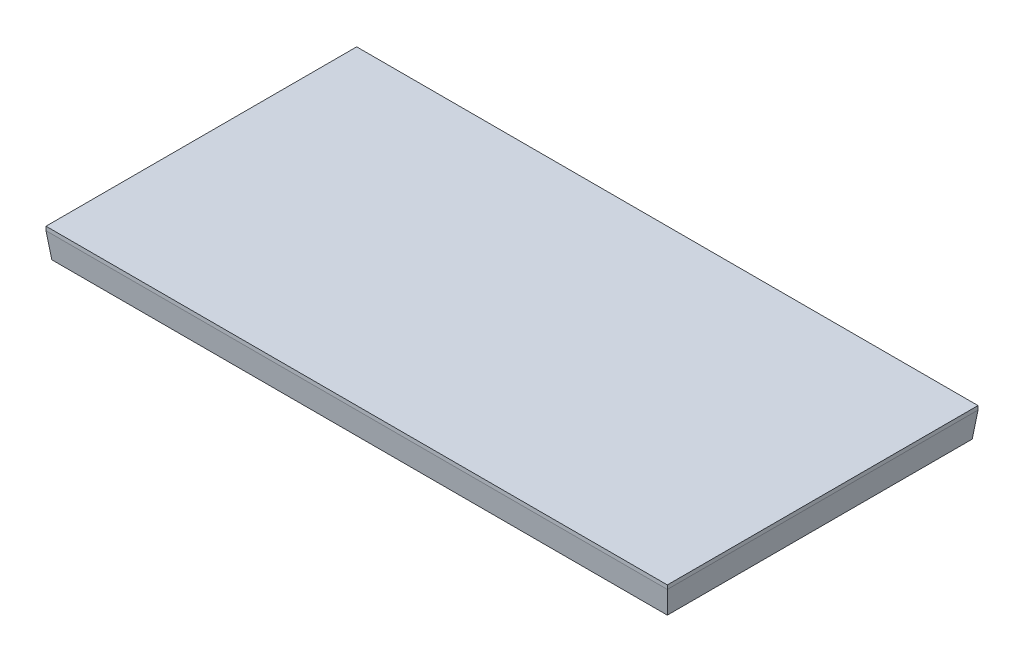
from build123d import *

# Parameters (mm, degrees)
SKETCH2_W                                  = 320
SKETCH2_H                                  = 160
BOSS_EXTRUDE1_DEPTH                        = 2
SKETCH3_R                                  = 1.6
CUT_EXTRUDE1_DEPTH                         = 7
CUT_EXTRUDE2_DEPTH                         = 12.5
MIRROR1_AT_THE_SECOND_PLANE_COPY_1_SKETC_R = 1.6
MIRROR1_AT_THE_SECOND_PLANE_COPY_1_DEPTH   = 7
MIRROR1_AT_THE_SECOND_PLANE_COPY_2_DEPTH   = 12.5
SKETCH4_W                                  = 8.5
SKETCH4_H                                  = 28
SKETCH4_W_2                                = 16
SKETCH4_H_2                                = 8
BOSS_EXTRUDE3_DEPTH                        = 10
SKETCH5_R                                  = 1.5
BOSS_EXTRUDE4_DEPTH                        = 2


with BuildPart() as part:
    # Sketch2 → Boss-Extrude1 (new body)
    with BuildSketch(Plane(origin=(0, 13, 0), x_dir=(1, 0, 0), z_dir=(0, 1, 0))):
        Rectangle(SKETCH2_W, SKETCH2_H)
    extrude(amount=BOSS_EXTRUDE1_DEPTH)

    # Sketch1 → Loft1 section 0
    with BuildSketch(Plane(origin=(0, 0, 0), x_dir=(1, 0, 0), z_dir=(0, 1, 0))):
        with BuildLine():
            Line((-158.5, -78.5), (158.5, -78.5))
            Line((158.5, -78.5), (158.5, 78.5))
            Line((158.5, 78.5), (-158.5, 78.5))
            Line((-158.5, 78.5), (-158.5, -78.5))
        make_face()
    # Sketch2<2> → Loft1 section 1
    with BuildSketch(Plane(origin=(0, 13, 0), x_dir=(1, 0, 0), z_dir=(0, 1, 0))):
        with BuildLine():
            Line((160, -80), (-160, -80))
            Line((-160, -80), (-160, 80))
            Line((-160, 80), (160, 80))
            Line((160, 80), (160, -80))
        make_face()
    loft()

    # Sketch3 → Cut-Extrude1 (cut)
    with BuildSketch(Plane.XZ):
        with Locations((0, 70)):
            Circle(SKETCH3_R)
        with Locations((-152, 70)):
            Circle(SKETCH3_R)
    cut_extrude1 = extrude(amount=-CUT_EXTRUDE1_DEPTH, mode=Mode.SUBTRACT)

    # Sketch3<4> → Cut-Extrude2 (cut)
    with BuildSketch(Plane.XZ):
        with BuildLine():
            Line((-150.2, 0), (-9, 0))
            Line((-9, 0), (-9, 67.9))
            Line((-9, 67.9), (-142.1, 67.9))
            ThreePointArc((-142.1, 67.9), (-145.281980515, 66.581980515), (-146.6, 63.4))
            Line((-146.6, 63.4), (-146.6, 22.75))
            Line((-146.6, 22.75), (-150.2, 19.75))
            Line((-150.2, 19.75), (-150.2, 0))
        make_face()
    cut_extrude2 = extrude(amount=-CUT_EXTRUDE2_DEPTH, mode=Mode.SUBTRACT)

    # Mirror1: Cut-Extrude1, Cut-Extrude2 across plane
    add(cut_extrude1.mirror(Plane.XY), mode=Mode.SUBTRACT)
    add(cut_extrude2.mirror(Plane.XY), mode=Mode.SUBTRACT)

    # Mirror1 at the second plane: Cut-Extrude1, Cut-Extrude2 across plane
    add(cut_extrude1.mirror(Plane(origin=(0, 0, 0), x_dir=(0, 0, 1), z_dir=(1, 0, 0))), mode=Mode.SUBTRACT)
    add(cut_extrude2.mirror(Plane(origin=(0, 0, 0), x_dir=(0, 0, 1), z_dir=(1, 0, 0))), mode=Mode.SUBTRACT)

    # Mirror1 at the second plane copy 1 sketc → Mirror1 at the second plane copy 1 (cut)
    with BuildSketch(Plane(origin=(0, 0, 0), x_dir=(-1, 0, 0), z_dir=(0, -1, 0))):
        with Locations((0, 70)):
            Circle(MIRROR1_AT_THE_SECOND_PLANE_COPY_1_SKETC_R)
        with Locations((-152, 70)):
            Circle(MIRROR1_AT_THE_SECOND_PLANE_COPY_1_SKETC_R)
    extrude(amount=-MIRROR1_AT_THE_SECOND_PLANE_COPY_1_DEPTH, mode=Mode.SUBTRACT)

    # Mirror1 at the second plane copy 2 sketc → Mirror1 at the second plane copy 2 (cut)
    with BuildSketch(Plane(origin=(0, 0, 0), x_dir=(-1, 0, 0), z_dir=(0, -1, 0))):
        with BuildLine():
            Line((-150.2, 0), (-9, 0))
            Line((-9, 0), (-9, 67.9))
            Line((-9, 67.9), (-142.1, 67.9))
            ThreePointArc((-142.1, 67.9), (-145.281980515, 66.581980515), (-146.6, 63.4))
            Line((-146.6, 63.4), (-146.6, 22.75))
            Line((-146.6, 22.75), (-150.2, 19.75))
            Line((-150.2, 19.75), (-150.2, 0))
        make_face()
    extrude(amount=-MIRROR1_AT_THE_SECOND_PLANE_COPY_2_DEPTH, mode=Mode.SUBTRACT)

    # Sketch4 → Boss-Extrude3 (add)
    with BuildSketch(Plane.XZ.offset(-12.5)):
        with Locations((-112.45, 0)):
            Rectangle(SKETCH4_W, SKETCH4_H)
        with Locations((112.45, 0)):
            Rectangle(SKETCH4_W, SKETCH4_H)
        with Locations((31, 13)):
            Rectangle(SKETCH4_W_2, SKETCH4_H_2)
    extrude(amount=BOSS_EXTRUDE3_DEPTH)

    # Sketch5 → Boss-Extrude4 (add)
    with BuildSketch(Plane.XZ):
        with Locations((-110, 71.5)):
            Circle(SKETCH5_R)
        with Locations((110, -71.5)):
            Circle(SKETCH5_R)
    extrude(amount=BOSS_EXTRUDE4_DEPTH)


solid = part.part
